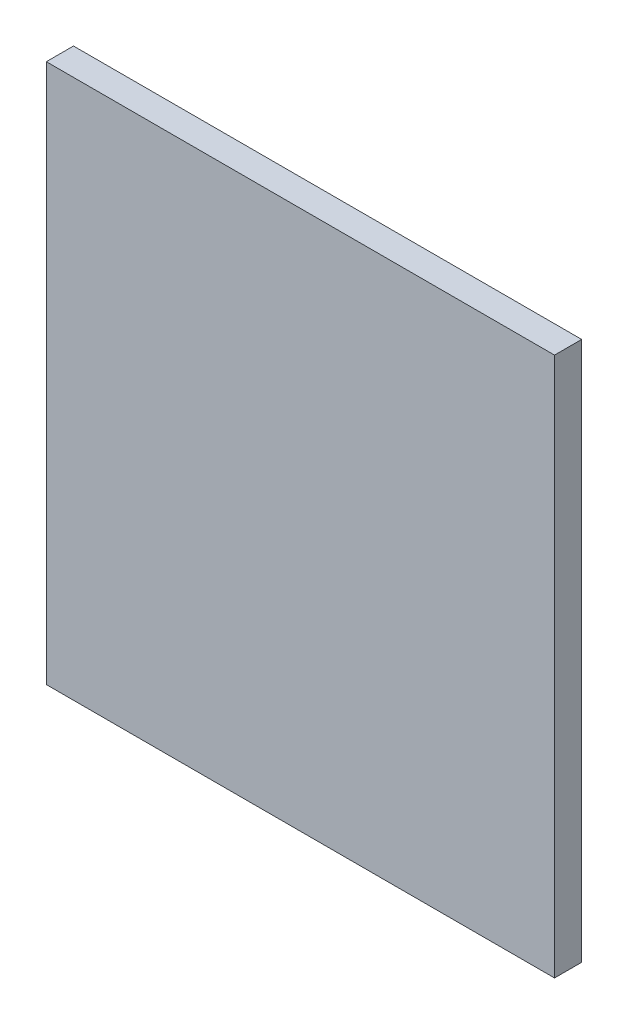
from build123d import *

# Parameters (mm, degrees)
CROQUIS1_W              = 65.5
CROQUIS1_H              = 74
SALIENTE_EXTRUIR1_DEPTH = 1.8
CROQUIS2_W              = 5
CROQUIS2_H              = 74
SALIENTE_EXTRUIR2_DEPTH = 15
CROQUIS3_W              = 3.4
CROQUIS3_H              = 2.1
CORTAR_EXTRUIR1_DEPTH   = 74
SALIENTE_EXTRUIR4_DEPTH = 1.8
CROQUIS7_W              = 14
CROQUIS7_H              = 23
SALIENTE_EXTRUIR5_DEPTH = 3
CORTAR_EXTRUIR5_DEPTH   = 23
CROQUIS10_R             = 1
CORTAR_EXTRUIR6_DEPTH   = 8
CORTAR_EXTRUIR7_START   = -8
CROQUIS11_R             = 1
CORTAR_EXTRUIR7_DEPTH   = 8
CORTAR_EXTRUIR8_START   = -19.8
CROQUIS12_W             = 72.040317055
CROQUIS12_H             = 80.937811448
CROQUIS12_W_2           = 33.677278507
CROQUIS12_H_2           = 35.747817065
CORTAR_EXTRUIR8_DEPTH   = 16.8


with BuildPart() as part:
    # Croquis1 → Saliente-Extruir1 (new body)
    with BuildSketch(Plane.XY):
        with Locations((-58.211538462, -2.192307692)):
            Rectangle(CROQUIS1_W, CROQUIS1_H)
    extrude(amount=SALIENTE_EXTRUIR1_DEPTH)

    # Croquis2 → Saliente-Extruir2 (add)
    with BuildSketch(Plane.XY.offset(1.8)):
        with Locations((-88.461538462, -2.192307692)):
            Rectangle(CROQUIS2_W, CROQUIS2_H)
        with Locations((-27.961538462, -2.192307692)):
            Rectangle(CROQUIS2_W, CROQUIS2_H)
    extrude(amount=SALIENTE_EXTRUIR2_DEPTH)

    # Croquis3 → Cortar-Extruir1 (cut)
    with BuildSketch(Plane.XZ.offset(39.192307692)):
        Polygon((-88.461538462, 16.8), (-89.111538462, 16.8), (-89.111538462, 15.9), (-87.811538462, 15.9), (-87.811538462, 16.8), align=None)
        with Locations((-87.661538462, 13.95)):
            Rectangle(CROQUIS3_W, CROQUIS3_H)
        with Locations((-28.761538462, 13.95)):
            Rectangle(CROQUIS3_W, CROQUIS3_H)
        Polygon((-28.611538462, 16.8), (-27.961538462, 16.8), (-27.311538462, 16.8), (-27.311538462, 15.9), (-28.611538462, 15.9), align=None)
    extrude(amount=-CORTAR_EXTRUIR1_DEPTH, mode=Mode.SUBTRACT)

    # Croquis6 → Saliente-Extruir4 (add)
    with BuildSketch(Plane.XZ.offset(39.192307692)):
        Polygon((-85.961538462, 8.7), (-80.961538462, 8.7), (-80.961538462, 1.8), (-45.461538462, 1.8), (-45.461538462, 5.7), (-30.461538462, 5.7), (-25.461538462, 5.7), (-25.461538462, 0), (-90.961538462, 0), (-90.961538462, 8.7), align=None)
    extrude(amount=SALIENTE_EXTRUIR4_DEPTH)

    # Croquis7 → Saliente-Extruir5 (add)
    with BuildSketch(Plane(origin=(0, 0, 0), x_dir=(-1, 0, 0), z_dir=(0, 0, -1))):
        with Locations((58.211538462, -3.092307692)):
            Rectangle(CROQUIS7_W, CROQUIS7_H)
    extrude(amount=SALIENTE_EXTRUIR5_DEPTH)

    # Croquis9 → Cortar-Extruir5 (cut)
    with BuildSketch(Plane.XZ.offset(14.592307692)):
        Polygon((-51.211538462, -3), (-54.211538462, 0), (-51.211538462, 0), align=None)
        Polygon((-65.211538462, -3), (-62.211538462, 0), (-65.211538462, 0), align=None)
    extrude(amount=-CORTAR_EXTRUIR5_DEPTH, mode=Mode.SUBTRACT)

    # Croquis10 → Cortar-Extruir6 (cut)
    with BuildSketch(Plane.XZ.offset(39.192307692)):
        with Locations(Location((-87.661538462, 10.9, 0), (0, 0, 270))):
            Circle(CROQUIS10_R)
        with Locations(Location((-28.761538462, 10.9, 0), (0, 0, 270))):
            Circle(CROQUIS10_R)
    extrude(amount=-CORTAR_EXTRUIR6_DEPTH, mode=Mode.SUBTRACT)

    # Croquis11 → Cortar-Extruir7 (cut)
    with BuildSketch(Plane(origin=(0, 34.807692308, 0), x_dir=(1, 0, 0), z_dir=(0, 1, 0)).offset(CORTAR_EXTRUIR7_START)):
        with Locations(Location((-28.761538462, -10.9, 0), (0, 0, 90))):
            Circle(CROQUIS11_R)
        with Locations(Location((-87.661538462, -10.9, 0), (0, 0, 90))):
            Circle(CROQUIS11_R)
    extrude(amount=CORTAR_EXTRUIR7_DEPTH, mode=Mode.SUBTRACT)

    # Croquis12 → Cortar-Extruir8 (cut)
    with BuildSketch(Plane(origin=(0, 0, -3), x_dir=(-1, 0, 0), z_dir=(0, 0, -1)).offset(CORTAR_EXTRUIR8_START)):
        with Locations((57.367684443, -4.300620435)):
            Rectangle(CROQUIS12_W, CROQUIS12_H)
        with Locations((57.760041523, -1.524971817)):
            Rectangle(CROQUIS12_W_2, CROQUIS12_H_2, mode=Mode.SUBTRACT)
    extrude(amount=CORTAR_EXTRUIR8_DEPTH, mode=Mode.SUBTRACT)


solid = part.part
